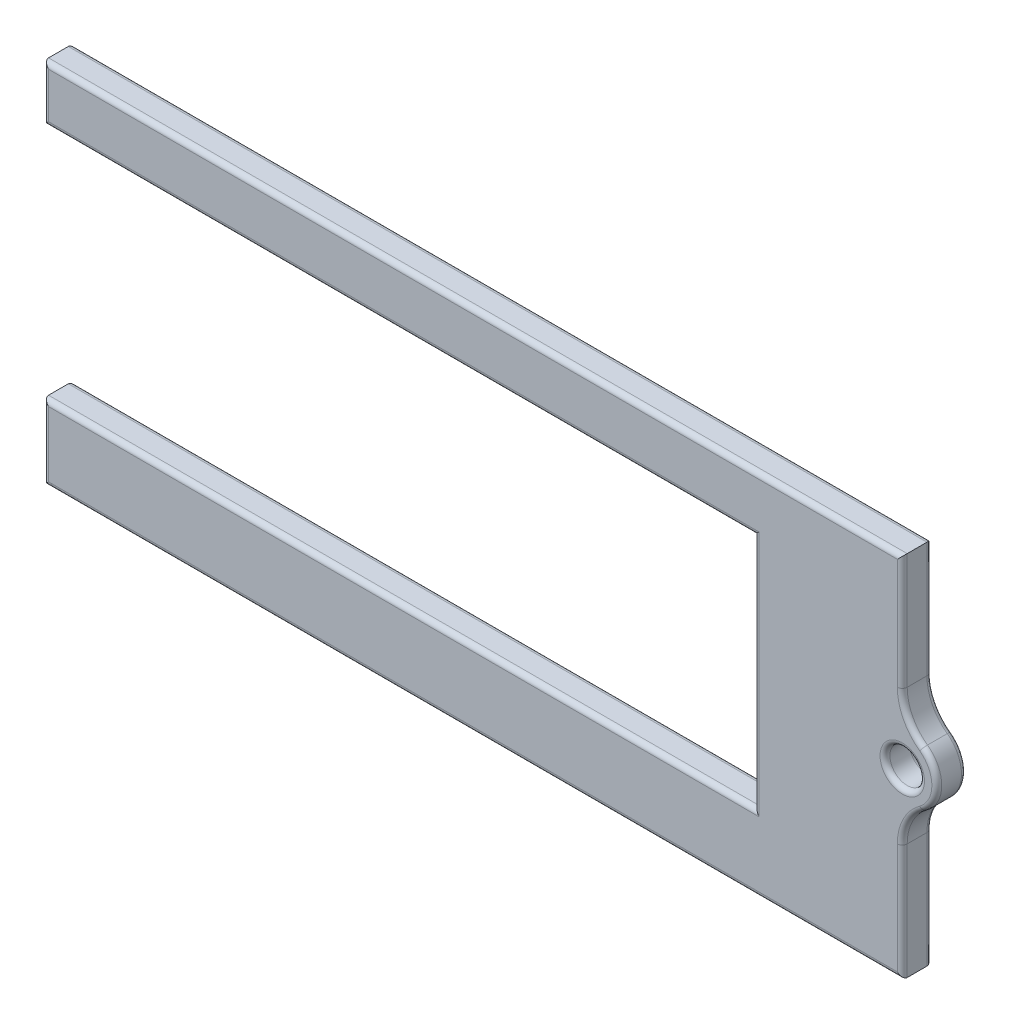
from build123d import *

# Parameters (mm, degrees)
SKETCH1_R           = 1.75
BOSS_EXTRUDE1_DEPTH = 3
FILLET1_R           = 0.5


with BuildPart() as part:
    # Sketch1 → Boss-Extrude1 (new body)
    with BuildSketch(Plane.XY):
        with BuildLine():
            Line((-266.5, 139.6), (-179.5, 139.6))
            Line((-179.5, 139.6), (-179.5, 127.873863542))
            ThreePointArc((-179.5, 127.873863542), (-178.955663943, 125.60515051), (-177.441176471, 123.8304144))
            ThreePointArc((-177.441176471, 123.8304144), (-176, 121), (-177.441176471, 118.1695856))
            ThreePointArc((-177.441176471, 118.1695856), (-178.955663943, 116.39484949), (-179.5, 114.126136458))
            Line((-179.5, 114.126136458), (-179.5, 102.4))
            Line((-179.5, 102.4), (-266.5, 102.4))
            Line((-266.5, 102.4), (-266.5, 110))
            Line((-266.5, 110), (-194.5, 110))
            Line((-194.5, 110), (-194.5, 134))
            Line((-194.5, 134), (-266.5, 134))
            Line((-266.5, 134), (-266.5, 139.6))
        make_face()
        with Locations((-179.5, 121)):
            Circle(SKETCH1_R, mode=Mode.SUBTRACT)
    extrude(amount=BOSS_EXTRUDE1_DEPTH)

    # Fillet1
    fillet1_edges = [part.edges().sort_by_distance(p)[0] for p in [
        (-178.955663943, 116.39484949, 0),
        (-179.5, 108.263068229, 0),
        (-179.5, 133.736931771, 3),
        (-223, 102.4, 0),
        (-266.5, 106.2, 0),
        (-230.5, 110, 0),
        (-194.5, 122, 0),
        (-230.5, 134, 0),
        (-266.5, 136.8, 0),
        (-223, 139.6, 0),
        (-179.5, 133.736931771, 0),
        (-178.955663943, 125.60515051, 0),
        (-176, 121, 0),
        (-223, 139.6, 3),
        (-266.5, 136.8, 3),
        (-230.5, 134, 3),
        (-194.5, 122, 3),
        (-181.25, 121, 0),
        (-181.25, 121, 3),
        (-230.5, 110, 3),
        (-266.5, 106.2, 3),
        (-223, 102.4, 3),
        (-179.5, 108.263068229, 3),
        (-178.955663943, 116.39484949, 3),
        (-176, 121, 3),
        (-178.955663943, 125.60515051, 3),
    ]]
    fillet(fillet1_edges, radius=FILLET1_R)


solid = part.part
